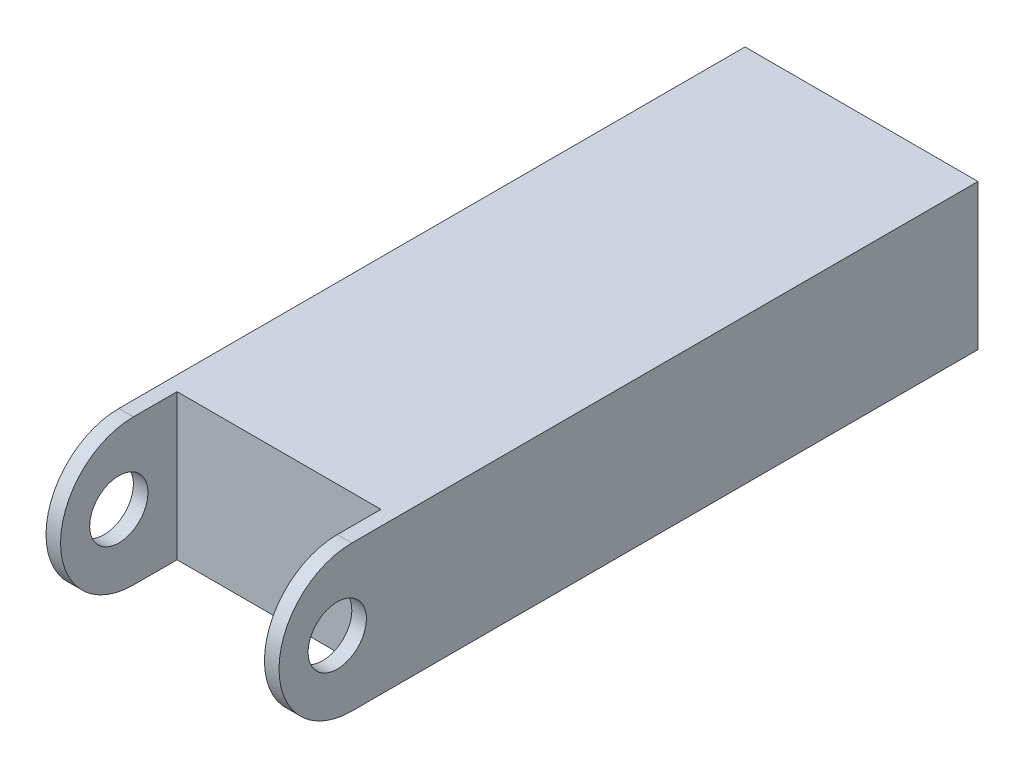
from build123d import *

# Parameters (mm, degrees)
SKETCH1_W                   = 80
SKETCH1_H                   = 50
BOSS_EXTRUDE1_DEPTH         = 200
SKETCH4_W                   = 40
SKETCH4_H                   = 50
SKETCH4_R                   = 10
BOSS_EXTRUDE3_DEPTH         = 5
FILLET1_RADIUS              = 25
FILLET1_LENGTH              = 5
FILLET1_OF_MIRROR1_2_RADIUS = 25
FILLET1_OF_MIRROR1_2_LENGTH = 5


with BuildPart() as part:
    # Sketch1 → Boss-Extrude1 (new body)
    with BuildSketch(Plane.XY):
        Rectangle(SKETCH1_W, SKETCH1_H)
    extrude(amount=-BOSS_EXTRUDE1_DEPTH)

    # Sketch4 → Boss-Extrude3 (add)
    with BuildSketch(Plane(origin=(40, 0, 0), x_dir=(0, 0, -1), z_dir=(1, 0, 0))):
        with Locations((-20, 0)):
            Rectangle(SKETCH4_W, SKETCH4_H)
        with Locations(Location((-20, 0, 0), (0, 0, 90))):
            Circle(SKETCH4_R, mode=Mode.SUBTRACT)
    boss_extrude3 = extrude(amount=-BOSS_EXTRUDE3_DEPTH)

    # Fillet1: full round fillet: the end face becomes a half cylinder, R = half its width
    fillet1_face = Plane((37.5, 0, 40), x_dir=(-1, 0, 0), z_dir=(0, 0, 1))  # on the end face: x along it, z out of the body
    fillet1_slab = fillet1_face.offset(-FILLET1_RADIUS / 2) * Box(FILLET1_LENGTH, 2 * FILLET1_RADIUS, FILLET1_RADIUS, mode=Mode.PRIVATE)  # the body's end, R deep
    fillet1_round = Plane((37.5, 0, 15), x_dir=(0, 0, 1), z_dir=(-1, 0, 0)) * Cylinder(FILLET1_RADIUS, FILLET1_LENGTH, mode=Mode.PRIVATE)  # its axis R under the face
    add(fillet1_slab - fillet1_round, mode=Mode.SUBTRACT)

    # Mirror1: Boss-Extrude3 across plane
    add(boss_extrude3.mirror(Plane(origin=(0, 0, 0), x_dir=(0, 0, 1), z_dir=(1, 0, 0))))

    # Fillet1 of Mirror1 2: full round fillet: the end face becomes a half cylinder, R = half its width
    fillet1_of_mirror1_2_face = Plane((-37.5, 0, 40), x_dir=(1, 0, 0), z_dir=(0, 0, 1))  # on the end face: x along it, z out of the body
    fillet1_of_mirror1_2_slab = fillet1_of_mirror1_2_face.offset(-FILLET1_OF_MIRROR1_2_RADIUS / 2) * Box(FILLET1_OF_MIRROR1_2_LENGTH, 2 * FILLET1_OF_MIRROR1_2_RADIUS, FILLET1_OF_MIRROR1_2_RADIUS, mode=Mode.PRIVATE)  # the body's end, R deep
    fillet1_of_mirror1_2_round = Plane((-37.5, 0, 15), x_dir=(0, 0, 1), z_dir=(1, 0, 0)) * Cylinder(FILLET1_OF_MIRROR1_2_RADIUS, FILLET1_OF_MIRROR1_2_LENGTH, mode=Mode.PRIVATE)  # its axis R under the face
    add(fillet1_of_mirror1_2_slab - fillet1_of_mirror1_2_round, mode=Mode.SUBTRACT)


solid = part.part
